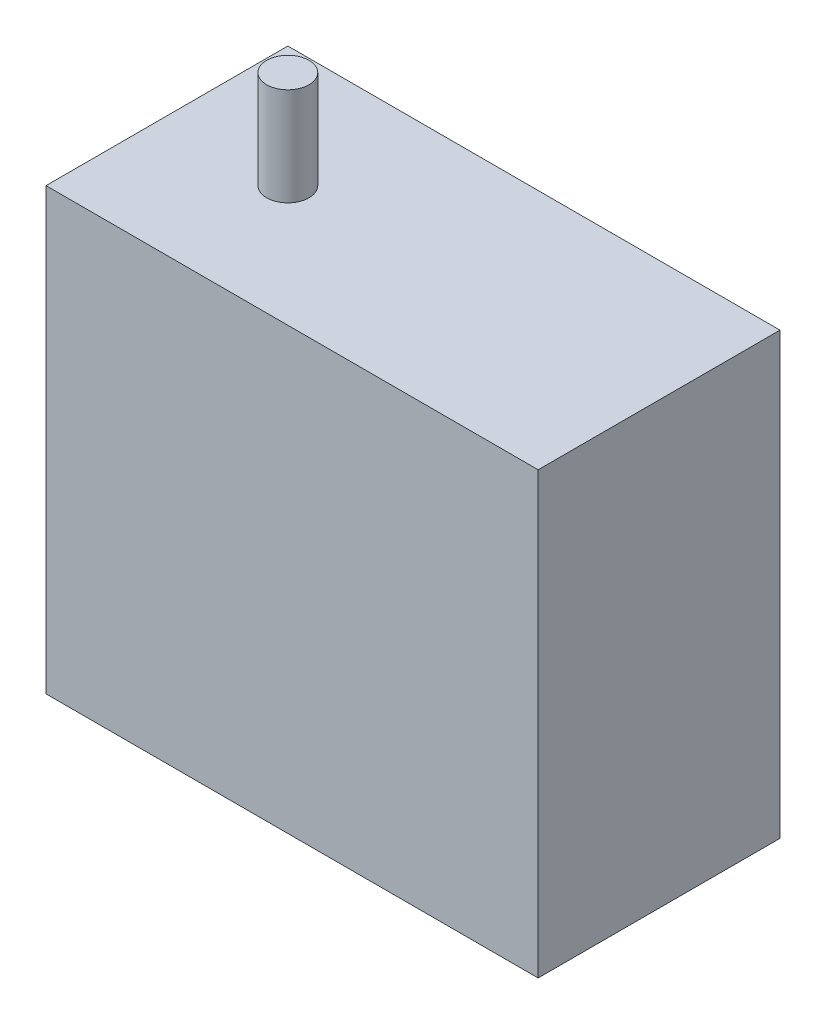
from build123d import *

# Parameters (mm, degrees)
SKETCH1_W           = 40.7
SKETCH1_H           = 20
BOSS_EXTRUDE1_DEPTH = 36.4
SKETCH2_R           = 1.75
BOSS_EXTRUDE2_DEPTH = 8.1


with BuildPart() as part:
    # Sketch1 → Boss-Extrude1 (new body)
    with BuildSketch(Plane(origin=(0, 0, 0), x_dir=(1, 0, 0), z_dir=(0, 1, 0))):
        Rectangle(SKETCH1_W, SKETCH1_H)
    extrude(amount=BOSS_EXTRUDE1_DEPTH)

    # Sketch2 → Boss-Extrude2 (add)
    with BuildSketch(Plane(origin=(0, 36.4, 0), x_dir=(1, 0, 0), z_dir=(0, 1, 0))):
        with Locations(Location((-10.35, 0, 0), (0, 0, 270))):
            Circle(SKETCH2_R)
    extrude(amount=BOSS_EXTRUDE2_DEPTH)


solid = part.part
